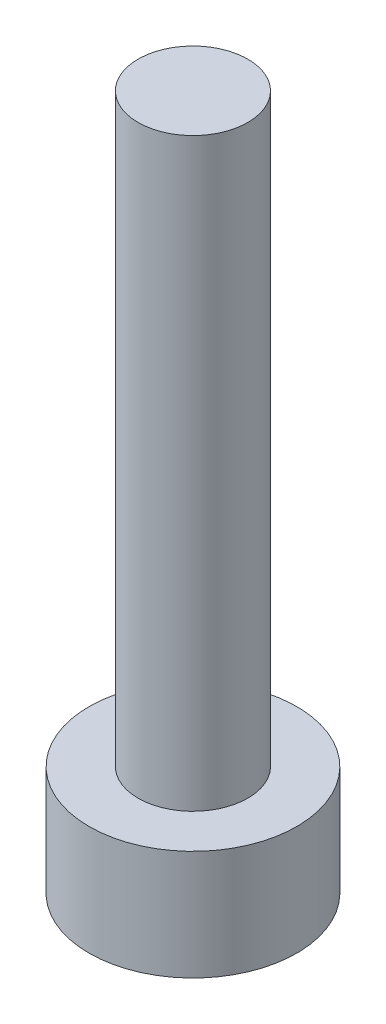
from build123d import *

# Parameters (mm, degrees)
SKETCH1_R           = 2.84
BOSS_EXTRUDE1_DEPTH = 3
SKETCH2_R           = 1.5
BOSS_EXTRUDE2_DEPTH = 16
CUT_EXTRUDE1_DEPTH  = 1.3


with BuildPart() as part:
    # Sketch1 → Boss-Extrude1 (new body)
    with BuildSketch(Plane(origin=(0, 0, 0), x_dir=(1, 0, 0), z_dir=(0, 1, 0))):
        with Locations(Location((0, 0, 0), (0, 0, 270))):
            Circle(SKETCH1_R)
    extrude(amount=BOSS_EXTRUDE1_DEPTH)

    # Sketch2 → Boss-Extrude2 (add)
    with BuildSketch(Plane(origin=(0, 3, 0), x_dir=(1, 0, 0), z_dir=(0, 1, 0))):
        with Locations(Location((0, 0, 0), (0, 0, 270))):
            Circle(SKETCH2_R)
    extrude(amount=BOSS_EXTRUDE2_DEPTH)

    # Sketch3 → Cut-Extrude1 (cut)
    with BuildSketch(Plane.XZ):
        Polygon((0.744781847, 1.29), (-0.744781847, 1.29), (-1.489563695, 0), (-0.744781847, -1.29), (0.744781847, -1.29), (1.489563695, 0), align=None)
    extrude(amount=-CUT_EXTRUDE1_DEPTH, mode=Mode.SUBTRACT)


solid = part.part
